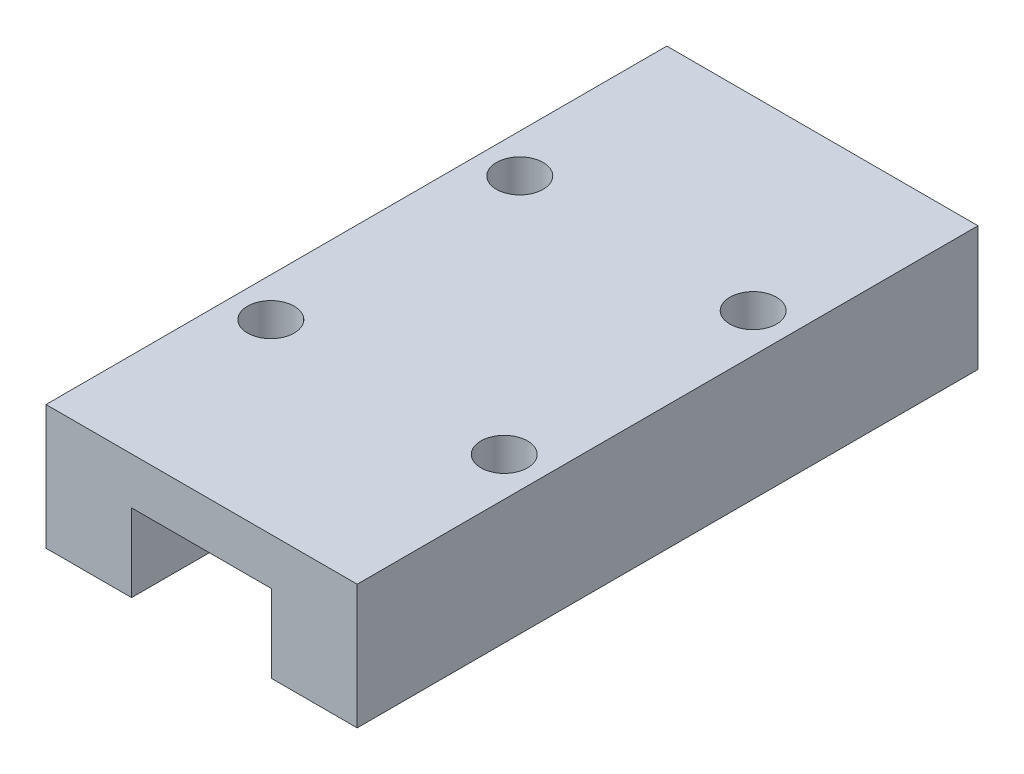
from build123d import *

# Parameters (mm, degrees)
EXTRUDE_1_DEPTH     = 39.9
SKETCH_2_R          = 1.5
CUT_EXTRUDE_1_DEPTH = 5


with BuildPart() as part:
    # 草图1 → 凸台-拉伸1 (new body)
    with BuildSketch(Plane.XY):
        Polygon((0, 0), (-5.5, 0), (-5.5, 5), (-14.5, 5), (-14.5, 0), (-20, 0), (-20, 8), (0, 8), align=None)
    extrude(amount=EXTRUDE_1_DEPTH)

    # 草图2 → 切除-拉伸1 (cut)
    with BuildSketch(Plane(origin=(0, 8, 0), x_dir=(1, 0, 0), z_dir=(0, 1, 0))):
        with Locations(Location((-17.5, -11.95, 0), (0, 0, 180))):
            Circle(SKETCH_2_R)
        with Locations((-2.5, -11.95)):
            Circle(SKETCH_2_R)
        with Locations(Location((-2.5, -27.95, 0), (0, 0, 180))):
            Circle(SKETCH_2_R)
        with Locations((-17.5, -27.95)):
            Circle(SKETCH_2_R)
    extrude(amount=-CUT_EXTRUDE_1_DEPTH, mode=Mode.SUBTRACT)


solid = part.part
